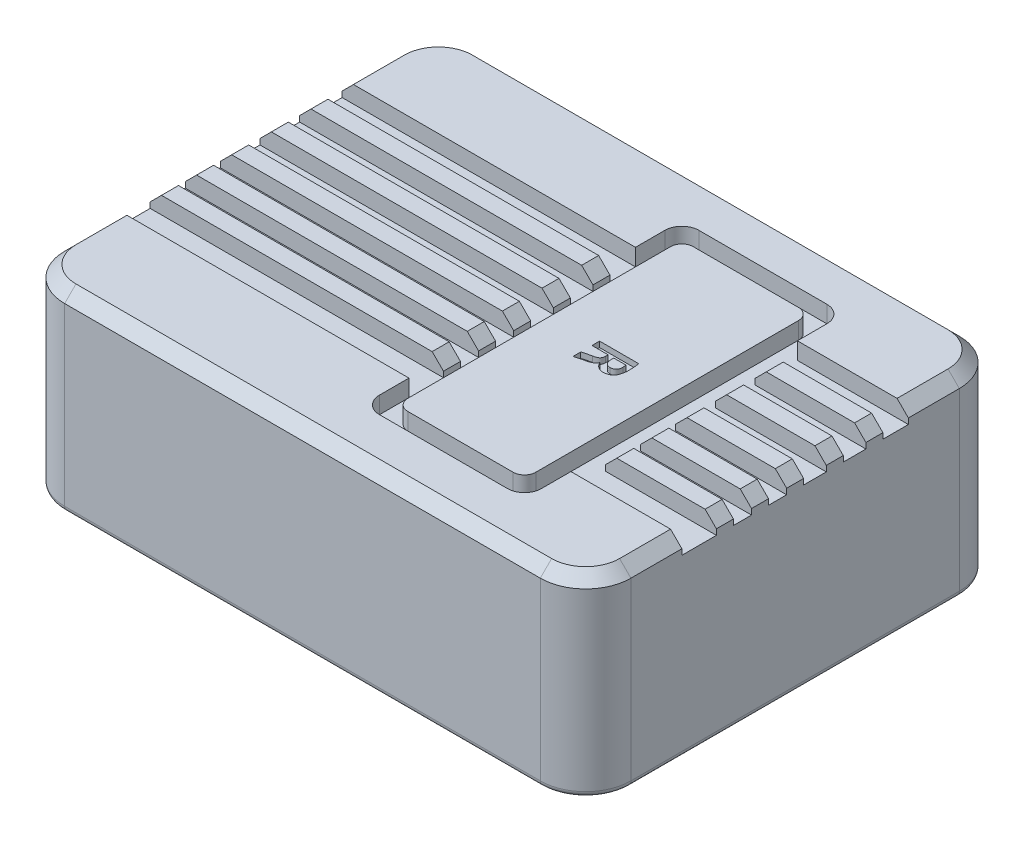
from build123d import *

# Parameters (mm, degrees)
EXTRUDE_1_DEPTH     = 17
SKETCH_3_W          = 9.8
SKETCH_3_H          = 20
SKETCH_3_W_2        = 14.3
SKETCH_3_W_3        = 25.9
CUT_EXTRUDE_1_DEPTH = 1.5
SKETCH_4_W          = 50
SKETCH_4_H          = 1.5
EXTRUDE_2_DEPTH     = 1.5
EXTRUDE_3_DEPTH     = 9.5
CUT_EXTRUDE_2_DEPTH = 1.5
CHAMFER_1_SIZE      = 1
FILLET_1_R          = 0.5
SKETCH_7_R          = 1
CUT_EXTRUDE_3_DEPTH = 5
CHAMFER_2_SIZE      = 0.5
CUT_EXTRUDE_4_DEPTH = 0.5


with BuildPart() as part:
    # 草图1 → 凸台-拉伸1 (new body)
    with BuildSketch(Plane(origin=(0, 0, 0), x_dir=(1, 0, 0), z_dir=(0, 1, 0))):
        with BuildLine():
            Line((-21, 18.5), (21, 18.5))
            ThreePointArc((21, 18.5), (23.828427125, 17.328427125), (25, 14.5))
            Line((25, 14.5), (25, -14.5))
            ThreePointArc((25, -14.5), (23.828427125, -17.328427125), (21, -18.5))
            Line((21, -18.5), (-21, -18.5))
            ThreePointArc((-21, -18.5), (-23.828427125, -17.328427125), (-25, -14.5))
            Line((-25, -14.5), (-25, 14.5))
            ThreePointArc((-25, 14.5), (-23.828427125, 17.328427125), (-21, 18.5))
        make_face()
    extrude(amount=EXTRUDE_1_DEPTH)

    # 草图3 → 切除-拉伸1 (cut)
    with BuildSketch(Plane(origin=(0, 17, 0), x_dir=(1, 0, 0), z_dir=(0, 1, 0))):
        with Locations((20.1, 0)):
            Rectangle(SKETCH_3_W, SKETCH_3_H)
        with Locations((8.05, 0)):
            Rectangle(SKETCH_3_W_2, SKETCH_3_H)
        with BuildLine():
            Line((13.7, 14.1), (2.4, 14.1))
            ThreePointArc((2.4, 14.1), (1.339339828, 13.660660172), (0.9, 12.6))
            Line((0.9, 12.6), (0.9, 10))
            Line((0.9, 10), (15.2, 10))
            Line((15.2, 10), (15.2, 12.6))
            ThreePointArc((15.2, 12.6), (14.760660172, 13.660660172), (13.7, 14.1))
        make_face()
        with BuildLine():
            Line((15.2, -10), (0.9, -10))
            Line((0.9, -10), (0.9, -12.6))
            ThreePointArc((0.9, -12.6), (1.339339828, -13.660660172), (2.4, -14.1))
            Line((2.4, -14.1), (13.7, -14.1))
            ThreePointArc((13.7, -14.1), (14.760660172, -13.660660172), (15.2, -12.6))
            Line((15.2, -12.6), (15.2, -10))
        make_face()
        with Locations((-12.05, 0)):
            Rectangle(SKETCH_3_W_3, SKETCH_3_H)
    extrude(amount=-CUT_EXTRUDE_1_DEPTH, mode=Mode.SUBTRACT)

    # 草图4 → 凸台-拉伸2 (add)
    with BuildSketch(Plane(origin=(0, 15.5, 0), x_dir=(1, 0, 0), z_dir=(0, 1, 0))):
        Rectangle(SKETCH_4_W, SKETCH_4_H)
        with Locations((0, 3.5)):
            Rectangle(SKETCH_4_W, SKETCH_4_H)
        with Locations((0, 7)):
            Rectangle(SKETCH_4_W, SKETCH_4_H)
        with Locations((0, -3.1)):
            Rectangle(SKETCH_4_W, SKETCH_4_H)
        with Locations((0, -6.2)):
            Rectangle(SKETCH_4_W, SKETCH_4_H)
    extrude(amount=EXTRUDE_2_DEPTH)

    # 草图5 → 凸台-拉伸3 (add)
    with BuildSketch(Plane(origin=(0, 17, 0), x_dir=(1, 0, 0), z_dir=(0, 1, 0))):
        with BuildLine():
            Line((3.4, 12.6), (12.7, 12.6))
            ThreePointArc((12.7, 12.6), (13.407106781, 12.307106781), (13.7, 11.6))
            Line((13.7, 11.6), (13.7, -11.6))
            ThreePointArc((13.7, -11.6), (13.407106781, -12.307106781), (12.7, -12.6))
            Line((12.7, -12.6), (3.4, -12.6))
            ThreePointArc((3.4, -12.6), (2.692893219, -12.307106781), (2.4, -11.6))
            Line((2.4, -11.6), (2.4, 11.6))
            ThreePointArc((2.4, 11.6), (2.692893219, 12.307106781), (3.4, 12.6))
        make_face()
    extrude(amount=-EXTRUDE_3_DEPTH)

    # 草图6 → 切除-拉伸2 (cut)
    with BuildSketch(Plane(origin=(0, 17, 0), x_dir=(1, 0, 0), z_dir=(0, 1, 0))):
        with BuildLine():
            Line((15.2, -10), (15.2, -12.6))
            ThreePointArc((15.2, -12.6), (14.760660172, -13.660660172), (13.7, -14.1))
            Line((13.7, -14.1), (2.4, -14.1))
            ThreePointArc((2.4, -14.1), (1.339339828, -13.660660172), (0.9, -12.6))
            Line((0.9, -12.6), (0.9, -10))
            Line((0.9, -10), (0.9, 10))
            Line((0.9, 10), (0.9, 12.6))
            ThreePointArc((0.9, 12.6), (1.339339828, 13.660660172), (2.4, 14.1))
            Line((2.4, 14.1), (13.7, 14.1))
            ThreePointArc((13.7, 14.1), (14.760660172, 13.660660172), (15.2, 12.6))
            Line((15.2, 12.6), (15.2, 10))
            Line((15.2, 10), (15.2, -10))
        make_face()
        with BuildLine():
            Line((13.7, -11.6), (13.7, -6.95))
            Line((13.7, -6.95), (13.7, 7.75))
            Line((13.7, 7.75), (13.7, 11.6))
            ThreePointArc((13.7, 11.6), (13.407106781, 12.307106781), (12.7, 12.6))
            Line((12.7, 12.6), (3.4, 12.6))
            ThreePointArc((3.4, 12.6), (2.692893219, 12.307106781), (2.4, 11.6))
            Line((2.4, 11.6), (2.4, 7.75))
            Line((2.4, 7.75), (2.4, -6.95))
            Line((2.4, -6.95), (2.4, -11.6))
            ThreePointArc((2.4, -11.6), (2.692893219, -12.307106781), (3.4, -12.6))
            Line((3.4, -12.6), (12.7, -12.6))
            ThreePointArc((12.7, -12.6), (13.407106781, -12.307106781), (13.7, -11.6))
        make_face(mode=Mode.SUBTRACT)
    extrude(amount=-CUT_EXTRUDE_2_DEPTH, mode=Mode.SUBTRACT)

    # 倒角1
    chamfer_1_edges = [part.edges().sort_by_distance(p)[0] for p in [
        (25, 17, -7),
        (-25, 17, -7),
        (25, 17, 3.1),
        (-25, 17, 3.1),
        (25, 17, 6.2),
        (-25, 17, 6.2),
        (-23.828427125, 17, 17.328427125),
        (0, 17, 18.5),
        (23.828427125, 17, 17.328427125),
        (25, 17, 12.25),
        (-25, 17, 12.25),
        (25, 17, -12.25),
        (23.828427125, 17, -17.328427125),
        (0, 17, -18.5),
        (0.9, 17, 0),
        (0.9, 17, -3.5),
        (0.9, 17, -7),
        (0.9, 17, 3.1),
        (0.9, 17, 6.2),
        (15.2, 17, 0),
        (15.2, 17, -3.5),
        (15.2, 17, -7),
        (15.2, 17, 3.1),
        (15.2, 17, 6.2),
        (-23.828427125, 17, -17.328427125),
        (25, 17, 0),
        (-25, 17, 0),
        (-25, 17, -12.25),
        (25, 17, -3.5),
        (-25, 17, -3.5),
    ]]
    chamfer(chamfer_1_edges, length=CHAMFER_1_SIZE)

    # 圆角1
    fillet_1_edges = [part.edges().sort_by_distance(p)[0] for p in [
        (0, 0, 18.5),
        (-23.828427125, 0, 17.328427125),
        (-25, 0, 0),
        (-23.828427125, 0, -17.328427125),
        (0, 0, -18.5),
        (23.828427125, 0, -17.328427125),
        (25, 0, 0),
        (23.828427125, 0, 17.328427125),
    ]]
    fillet(fillet_1_edges, radius=FILLET_1_R)

    # 草图7 → 切除-拉伸3 (cut)
    with BuildSketch(Plane.XZ):
        with Locations(Location((21.5, 0, 0), (0, 0, 270))):
            Circle(SKETCH_7_R)
        with Locations(Location((-21, 14.5, 0), (0, 0, 270))):
            Circle(SKETCH_7_R)
        with Locations(Location((-21, -14.5, 0), (0, 0, 270))):
            Circle(SKETCH_7_R)
    extrude(amount=-CUT_EXTRUDE_3_DEPTH, mode=Mode.SUBTRACT)

    # 倒角2
    chamfer_2_edges = [part.edges().sort_by_distance(p)[0] for p in [
        (21.5, 0, 1),
        (-21, 0, 15.5),
        (-21, 0, -13.5),
    ]]
    chamfer(chamfer_2_edges, length=CHAMFER_2_SIZE)

    # 草图8 → 切除-拉伸4 (cut)
    with BuildSketch(Plane(origin=(0, 17, 0), x_dir=(1, 0, 0), z_dir=(0, 1, 0))):
        with BuildLine():
            Line((6.489199884, 1.244745239), (6.489199884, 0.574307066))
            Line((6.489199884, 0.574307066), (7.912281488, 0.574307066))
            Line((7.912281488, 0.574307066), (7.912281488, 0.346763358))
            add(Edge.make_bspline(
                [(7.912281488, 0.346763358), (7.912138132, 0.327795019), (7.911857751, 0.290696254), (7.906489112, 0.236818623), (7.897569788, 0.186100719), (7.883425693, 0.139141617), (7.866033364, 0.09519292), (7.842880377, 0.055329559), (7.816859375, 0.018011104), (7.785061974, -0.015474885), (7.747991794, -0.045982674), (7.705747983, -0.075348994), (7.656362128, -0.101509668), (7.600785234, -0.125606649), (7.539412523, -0.14873721), (7.471865664, -0.169997399), (7.397658173, -0.188102365), (7.3459203, -0.198796665), (7.3190505, -0.204350695)],
                knots=[0, 0, 0, 0, 1.007158808, 1.969827093, 2.872781137, 3.737898967, 4.571102737, 5.376901638, 6.181004475, 6.982811936, 7.820591089, 8.728069734, 9.710947837, 10.783431542, 11.944485248, 13.193566999, 14.542493353, 16, 16, 16, 16], degree=3))
            add(Edge.make_bspline(
                [(7.3190505, -0.204350695), (7.267775191, -0.214564525), (7.169492076, -0.234142116), (7.028589715, -0.264256454), (6.90115837, -0.294848666), (6.787128865, -0.323043724), (6.688938626, -0.351900261), (6.606497428, -0.376175848), (6.54135768, -0.398776116), (6.504680399, -0.415098195), (6.488922142, -0.422110916)],
                knots=[0, 0, 0, 0, 1.459770129, 2.798047569, 4.022515533, 5.118804131, 6.077119604, 6.879484601, 7.518574734, 8, 8, 8, 8], degree=3))
            Line((6.488922142, -0.422110916), (6.489199884, -1.111438139))
            add(Edge.make_bspline(
                [(6.489199884, -1.111438139), (6.510352411, -1.102489831), (6.558930577, -1.081939456), (6.643223098, -1.053498243), (6.748154726, -1.024490558), (6.870514814, -0.992757876), (7.006294312, -0.960240222), (7.150208395, -0.92482649), (7.30078001, -0.8894654), (7.403296306, -0.865334487), (7.455645548, -0.853012202)],
                knots=[0, 0, 0, 0, 0.550314401, 1.263833125, 2.129869305, 3.159142062, 4.293235137, 5.475920025, 6.711095931, 8, 8, 8, 8], degree=3))
            add(Edge.make_bspline(
                [(7.455645548, -0.853012202), (7.49850247, -0.842680439), (7.581339782, -0.822710376), (7.698067014, -0.78305718), (7.803358527, -0.737544107), (7.897059188, -0.685793476), (7.979097899, -0.625909584), (8.048634337, -0.557078798), (8.104491907, -0.477911823), (8.131143453, -0.419726759), (8.144559702, -0.390436702)],
                knots=[0, 0, 0, 0, 1.223024066, 2.363959412, 3.416475858, 4.403144149, 5.328653403, 6.226529264, 7.107244077, 8, 8, 8, 8], degree=3))
            Line((8.144559702, -0.390436702), (8.158479678, -0.390296864))
            add(Edge.make_bspline(
                [(8.158479678, -0.390296864), (8.176109789, -0.431262481), (8.211210773, -0.51282371), (8.286586418, -0.623497542), (8.375742147, -0.724989866), (8.462431957, -0.79999991), (8.539421636, -0.852558161), (8.600726564, -0.887514508), (8.665112648, -0.917505374), (8.732813006, -0.941733054), (8.803521203, -0.961749071), (8.877687935, -0.976092498), (8.954879863, -0.985522015), (9.007435163, -0.987357183), (9.034077211, -0.988287491)],
                knots=[0, 0, 0, 0, 1.421158178, 2.829480325, 4.252609904, 5.726645356, 6.474673747, 7.226451348, 7.977441196, 8.739482559, 9.519942951, 10.32157274, 11.149148792, 12, 12, 12, 12], degree=3))
            add(Edge.make_bspline(
                [(9.034077211, -0.988287491), (9.061385105, -0.986416961), (9.115050019, -0.982741034), (9.193131056, -0.971767656), (9.267623201, -0.958763218), (9.337972653, -0.942480017), (9.40448169, -0.922495455), (9.467146912, -0.899539846), (9.52594067, -0.873333215), (9.58053322, -0.843301706), (9.631131368, -0.810295249), (9.678674706, -0.77497693), (9.720584955, -0.734670974), (9.760238146, -0.69259263), (9.794797023, -0.646211258), (9.826368598, -0.59704935), (9.853167171, -0.544294268), (9.883363896, -0.470611099), (9.914284465, -0.377124621), (9.9488251, -0.267051504), (9.974724002, -0.158621734), (9.99645839, -0.053555447), (10.010498993, 0.04921883), (10.020610863, 0.149118735), (10.02226703, 0.24661112), (10.019377645, 0.310585454), (10.017957483, 0.342029496)],
                knots=[0, 0, 0, 0, 1.04254728, 2.048792541, 3.00224853, 3.923105087, 4.79804786, 5.646501919, 6.464227683, 7.248100506, 8.017504481, 8.765055913, 9.500244792, 10.229727568, 10.965537121, 11.700200404, 12.45355415, 13.216173449, 14.732128481, 16.203485081, 17.610025167, 18.977448705, 20.289434687, 21.560307215, 22.800865913, 24, 24, 24, 24], degree=3))
            add(Edge.make_bspline(
                [(10.017957483, 0.342029496), (10.016980152, 0.426299735), (10.015074871, 0.590582388), (10.001760282, 0.792286317), (9.987482685, 0.945038992), (9.975686474, 1.051087832), (9.96265636, 1.150342359), (9.952339606, 1.213972696), (9.947350381, 1.244744595)],
                knots=[0, 0, 0, 0, 1.673332579, 3.262118607, 4.012319707, 4.719959197, 5.38096689, 6, 6, 6, 6], degree=3))
            Line((9.947350381, 1.244744595), (6.489199884, 1.244745239))
        make_face()
        with BuildLine():
            add(Edge.make_bspline(
                [(9.489545474, 0.574307066), (9.493804859, 0.557436259), (9.503659978, 0.518401562), (9.510917032, 0.449524049), (9.516286973, 0.36323992), (9.51639182, 0.299592412), (9.516449095, 0.2648236)],
                knots=[0, 0, 0, 0, 0.669556034, 1.549180025, 2.661187206, 4, 4, 4, 4], degree=3))
            add(Edge.make_bspline(
                [(9.516449095, 0.2648236), (9.516671284, 0.231967429), (9.517114802, 0.166382516), (9.497836833, 0.068546576), (9.465268497, -0.027599253), (9.42674794, -0.105520291), (9.386285532, -0.163789858), (9.347977249, -0.202658092), (9.302529268, -0.235572972), (9.25037633, -0.263932207), (9.190634947, -0.284713872), (9.124825869, -0.302422429), (9.05176846, -0.313271754), (9.000675754, -0.316280658), (8.97402818, -0.317849961)],
                knots=[0, 0, 0, 0, 1.29989643, 2.594751302, 3.929547968, 5.318022419, 6.024638324, 6.733832736, 7.469917789, 8.242501489, 9.078489731, 9.971146527, 10.941844606, 12, 12, 12, 12], degree=3))
            add(Edge.make_bspline(
                [(8.97402818, -0.317849961), (8.95332289, -0.317110855), (8.912864187, -0.315666622), (8.853951102, -0.307480092), (8.797780479, -0.295390038), (8.745469031, -0.276523379), (8.695529423, -0.254176862), (8.649597356, -0.225751649), (8.607026145, -0.192192573), (8.567272457, -0.154784309), (8.531732918, -0.112443128), (8.5003971, -0.066171348), (8.474683131, -0.015184647), (8.453011646, 0.039351229), (8.435663959, 0.098081122), (8.4234573, 0.160613426), (8.41528239, 0.227223421), (8.413862464, 0.272937165), (8.413130641, 0.296497814)],
                knots=[0, 0, 0, 0, 1.059418694, 2.070133086, 3.039393338, 3.993307784, 4.909841662, 5.83442482, 6.748467736, 7.679875486, 8.622301396, 9.571223408, 10.532610832, 11.537858976, 12.570578314, 13.660929848, 14.794454277, 16, 16, 16, 16], degree=3))
            Line((8.413130641, 0.296497814), (8.413789876, 0.574307066))
            Line((8.413789876, 0.574307066), (9.489545474, 0.574307066))
        make_face(mode=Mode.SUBTRACT)
    extrude(amount=-CUT_EXTRUDE_4_DEPTH, mode=Mode.SUBTRACT)


solid = part.part
